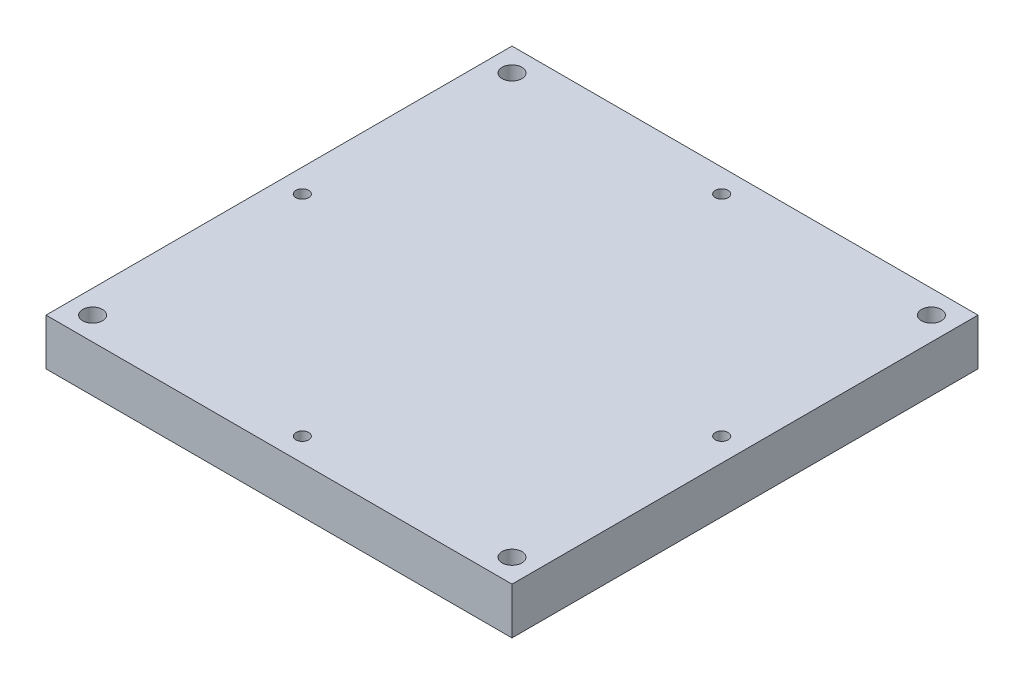
from build123d import *

# Parameters (mm, degrees)
TOWERBASE_W          = 200
TOWERBASE_H          = 200
TOWERBASEPLATE_DEPTH = 20
SCREWHOLES_R         = 4.25
SCREWHOLES_R_2       = 2.75
HOLES_DEPTH          = 284.548937575


with BuildPart() as part:
    # TowerBase → TowerBasePlate (new body)
    with BuildSketch(Plane(origin=(0, 0, 0), x_dir=(1, 0, 0), z_dir=(0, 1, 0))):
        with Locations((100, 100)):
            Rectangle(TOWERBASE_W, TOWERBASE_H)
    extrude(amount=TOWERBASEPLATE_DEPTH)

    # ScrewHoles → Holes (cut, through all)
    with BuildSketch(Plane(origin=(0, 20, 0), x_dir=(1, 0, 0), z_dir=(0, 1, 0))):
        with Locations(Location((10, 10, 0), (0, 0, 270))):
            Circle(SCREWHOLES_R)
        with Locations(Location((190, 10, 0), (0, 0, 270))):
            Circle(SCREWHOLES_R)
        with Locations(Location((190, 190, 0), (0, 0, 270))):
            Circle(SCREWHOLES_R)
        with Locations(Location((10, 190, 0), (0, 0, 270))):
            Circle(SCREWHOLES_R)
        with Locations(Location((10, 100, 0), (0, 0, 270))):
            Circle(SCREWHOLES_R_2)
        with Locations(Location((190, 100, 0), (0, 0, 270))):
            Circle(SCREWHOLES_R_2)
        with Locations(Location((100, 190, 0), (0, 0, 270))):
            Circle(SCREWHOLES_R_2)
        with Locations(Location((100, 10, 0), (0, 0, 270))):
            Circle(SCREWHOLES_R_2)
    extrude(amount=-HOLES_DEPTH, mode=Mode.SUBTRACT)


solid = part.part
